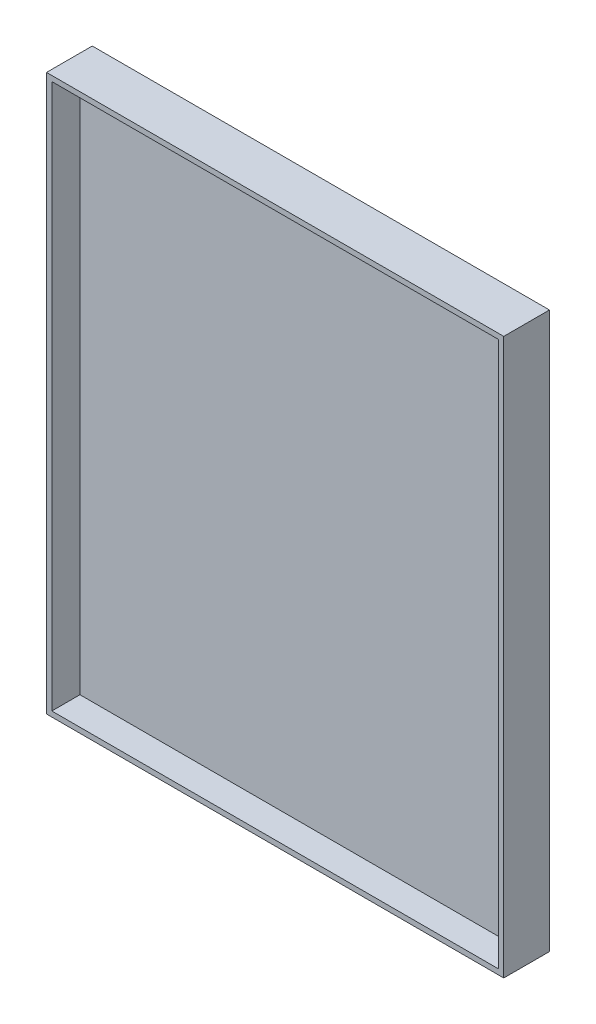
from build123d import *

# Parameters (mm, degrees)
CROQUIS1_W              = 130
CROQUIS1_H              = 158
SALIENTE_EXTRUIR1_DEPTH = 5
CROQUIS2_W              = 130
CROQUIS2_H              = 158
CROQUIS2_W_2            = 127
CROQUIS2_H_2            = 155
SALIENTE_EXTRUIR2_DEPTH = 8


with BuildPart() as part:
    # Croquis1 → Saliente-Extruir1 (new body)
    with BuildSketch(Plane.XY):
        Rectangle(CROQUIS1_W, CROQUIS1_H)
    extrude(amount=SALIENTE_EXTRUIR1_DEPTH)

    # Croquis2 → Saliente-Extruir2 (add)
    with BuildSketch(Plane.XY.offset(5)):
        Rectangle(CROQUIS2_W, CROQUIS2_H)
        Rectangle(CROQUIS2_W_2, CROQUIS2_H_2, mode=Mode.SUBTRACT)
    extrude(amount=SALIENTE_EXTRUIR2_DEPTH)


solid = part.part
